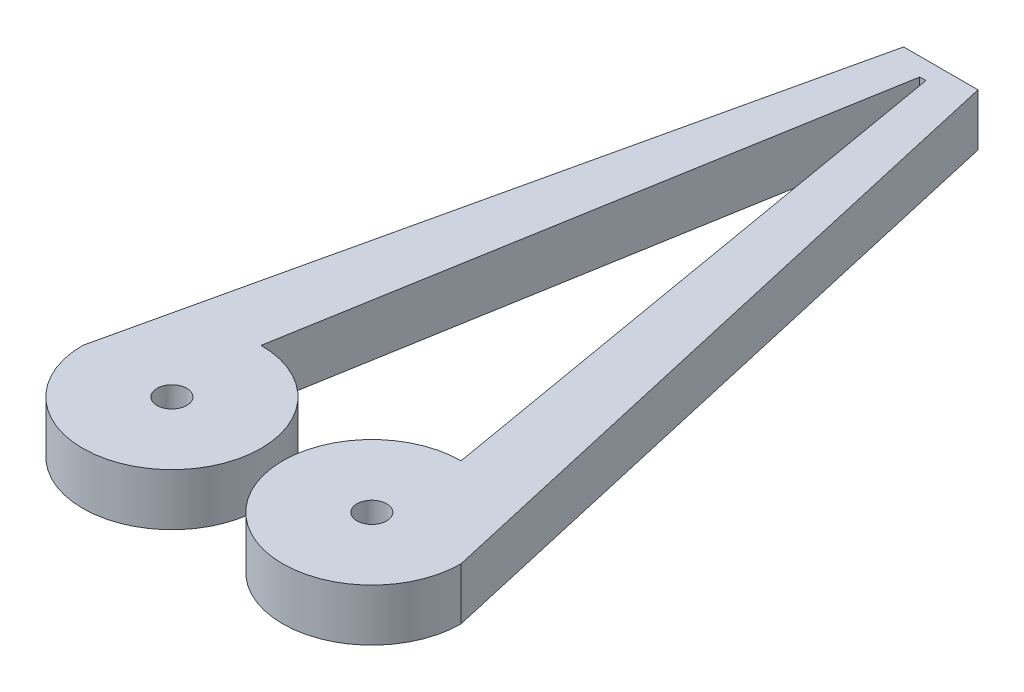
from build123d import *

# Parameters (mm, degrees)
SKETCH1_R           = 2
BOSS_EXTRUDE1_DEPTH = 7


with BuildPart() as part:
    # Sketch1 → Boss-Extrude1 (new body)
    with BuildSketch(Plane(origin=(0, 0, 0), x_dir=(1, 0, 0), z_dir=(0, 1, 0))):
        with BuildLine():
            Line((13.032630063, 87.579564679), (13.867369937, 87.579564679))
            Line((13.867369937, 87.579564679), (26.9, 12))
            ThreePointArc((26.9, 12), (18.414718626, -8.485281374), (38.9, 0))
            Line((38.9, 0), (18.45, 90))
            Line((18.45, 90), (13.45, 90))
            Line((13.45, 90), (8.45, 90))
            Line((8.45, 90), (-12, 0))
            ThreePointArc((-12, 0), (8.485281374, -8.485281374), (0, 12))
            Line((0, 12), (13.032630063, 87.579564679))
        make_face()
        with Locations(Location((0, 0, 0), (0, 0, 270))):
            Circle(SKETCH1_R, mode=Mode.SUBTRACT)
        with Locations(Location((26.9, 0, 0), (0, 0, 270))):
            Circle(SKETCH1_R, mode=Mode.SUBTRACT)
    extrude(amount=BOSS_EXTRUDE1_DEPTH)


solid = part.part
